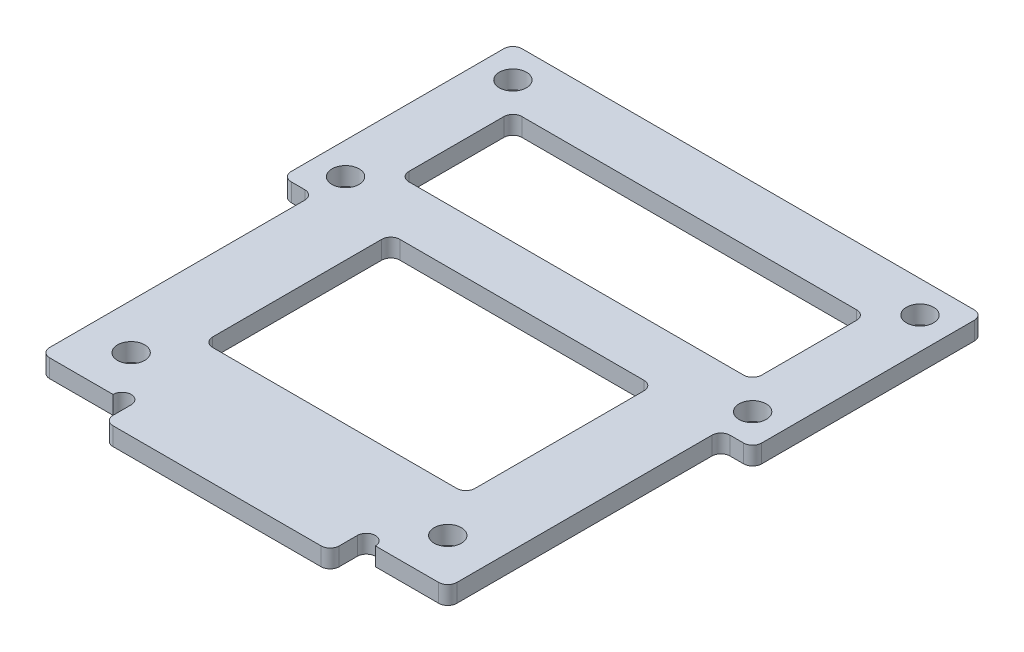
from build123d import *

# Parameters (mm, degrees)
SKETCH_1_R          = 1.5
SKETCH_1_W          = 39
SKETCH_1_H          = 12.5
EXTRUDE_1_DEPTH     = 2
SKETCH_2_R          = 1
SKETCH_2_W          = 29
SKETCH_2_H          = 20.7
CUT_EXTRUDE_1_DEPTH = 65.231534311
FILLET_1_R          = 1


with BuildPart() as part:
    # 草图1 → 凸台-拉伸1 (new body)
    with BuildSketch(Plane(origin=(0, 0, 0), x_dir=(1, 0, 0), z_dir=(0, 1, 0))):
        Polygon((-22.5, 3), (-22.5, 33.2), (-26, 33.2), (-26, 58.7), (26, 58.7), (26, 33.2), (22.5, 33.2), (22.5, 3), (12.5, 3), (12.5, 0), (-12.5, 0), (-12.5, 3), align=None)
        with Locations(Location((-22.5, 55.2, 0), (0, 0, 270))):
            Circle(SKETCH_1_R, mode=Mode.SUBTRACT)
        with Locations(Location((-22.5, 36.7, 0), (0, 0, 270))):
            Circle(SKETCH_1_R, mode=Mode.SUBTRACT)
        with Locations(Location((22.5, 36.7, 0), (0, 0, 90))):
            Circle(SKETCH_1_R, mode=Mode.SUBTRACT)
        with Locations(Location((22.5, 55.2, 0), (0, 0, 90))):
            Circle(SKETCH_1_R, mode=Mode.SUBTRACT)
        with Locations(Location((-17.5, 8, 0), (0, 0, 270))):
            Circle(SKETCH_1_R, mode=Mode.SUBTRACT)
        with Locations(Location((17.5, 8, 0), (0, 0, 90))):
            Circle(SKETCH_1_R, mode=Mode.SUBTRACT)
        with Locations((0, 45.95)):
            Rectangle(SKETCH_1_W, SKETCH_1_H, mode=Mode.SUBTRACT)
    extrude(amount=EXTRUDE_1_DEPTH)

    # 草图2 → 切除-拉伸1 (cut, through all)
    with BuildSketch(Plane(origin=(0, 2, 0), x_dir=(1, 0, 0), z_dir=(0, 1, 0))):
        with Locations((-13.5, 3)):
            Circle(SKETCH_2_R)
        with Locations((13.5, 3)):
            Circle(SKETCH_2_R)
        with Locations((0, 23.35)):
            Rectangle(SKETCH_2_W, SKETCH_2_H)
    extrude(amount=-CUT_EXTRUDE_1_DEPTH, mode=Mode.SUBTRACT)

    # 圆角1
    fillet_1_edges = [part.edges().sort_by_distance(p)[0] for p in [
        (26, 1, -33.2),
        (22.5, 1, -33.2),
        (22.5, 1, -3),
        (12.5, 1, 0),
        (-12.5, 1, 0),
        (-22.5, 1, -3),
        (-22.5, 1, -33.2),
        (-26, 1, -33.2),
        (-26, 1, -58.7),
        (26, 1, -58.7),
        (-19.5, 1, -52.2),
        (-19.5, 1, -39.7),
        (19.5, 1, -39.7),
        (19.5, 1, -52.2),
        (-14.5, 1, -13),
        (-14.5, 1, -33.7),
        (14.5, 1, -33.7),
        (14.5, 1, -13),
    ]]
    fillet(fillet_1_edges, radius=FILLET_1_R)


solid = part.part
